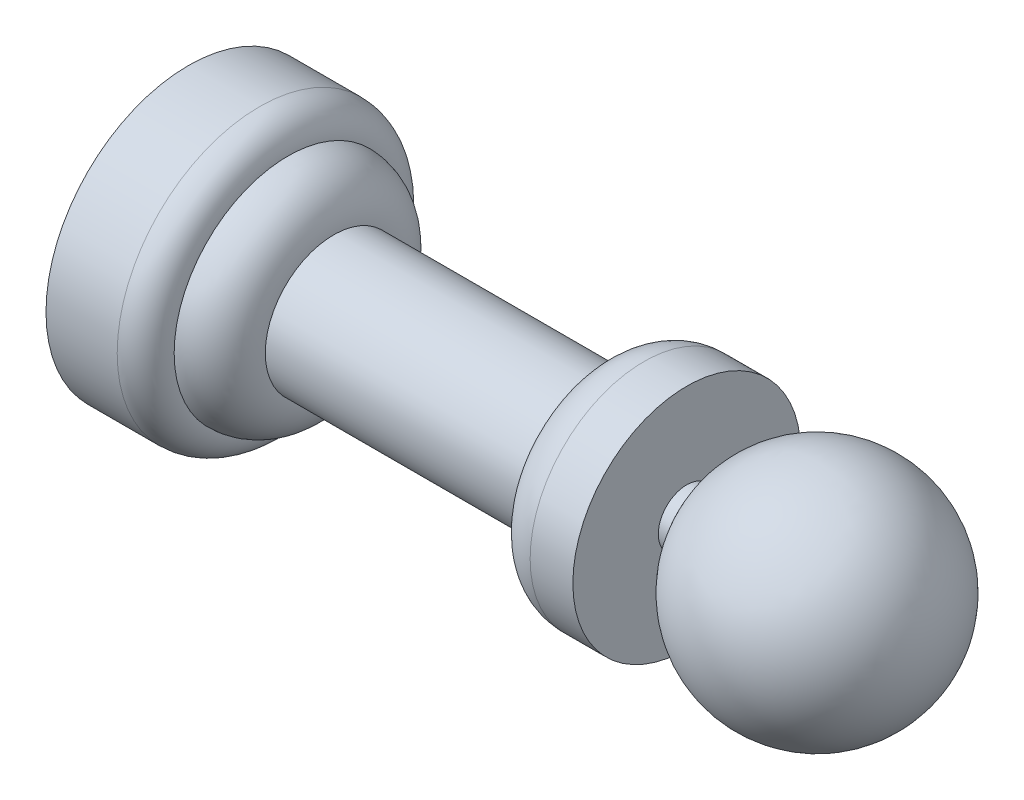
from build123d import *

# Parameters (mm, degrees)
SKETCH_1_W = 1.4
SKETCH_1_H = 2


with BuildPart() as part:
    # Эскиз1 → Повернуть8 (revolve)
    with BuildSketch(Plane.XY, mode=Mode.PRIVATE) as revolve_8_sk:
        with BuildLine():
            Line((28.8, 4.8), (10.2, 4.8))
            Line((10.2, 4.8), (10.2, 0))
            Line((10.2, 0), (32, 0))
            Line((32, 0), (32, 8))
            ThreePointArc((32, 8), (29.7372583, 7.0627417), (28.8, 4.8))
        make_face()
        with BuildLine():
            ThreePointArc((10.2, 4.8), (9.2627417, 7.0627417), (7, 8))
            Line((7, 8), (7, 0))
            Line((7, 0), (10.2, 0))
            Line((10.2, 0), (10.2, 4.8))
        make_face()
        with BuildLine():
            Line((0, 10), (0, 0))
            Line((0, 0), (1, 0))
            Line((1, 0), (1, 5.25))
            Line((1, 5.25), (3.5, 5.25))
            Line((3.5, 5.25), (3.5, 0))
            Line((3.5, 0), (7, 0))
            Line((7, 0), (7, 8))
            ThreePointArc((7, 8), (6.414213562, 9.414213562), (5, 10))
            Line((5, 10), (0, 10))
        make_face()
        Polygon((32, 8), (32, 0), (35, 0), (35, 2), (35, 8), align=None)
        with Locations((35.7, 1)):
            Rectangle(SKETCH_1_W, SKETCH_1_H)
        with BuildLine():
            Line((36.4, 2), (36.4, 0))
            Line((36.4, 0), (52.145966692, 0))
            ThreePointArc((52.145966692, 0), (45.154001032, 7.93623757), (36.4, 2))
        make_face()
    revolve(revolve_8_sk.sketch.rotate(Axis((0, 0, 0), (1, 0, 0)), 90), axis=Axis((0, 0, 0), (1, 0, 0)))


solid = part.part
